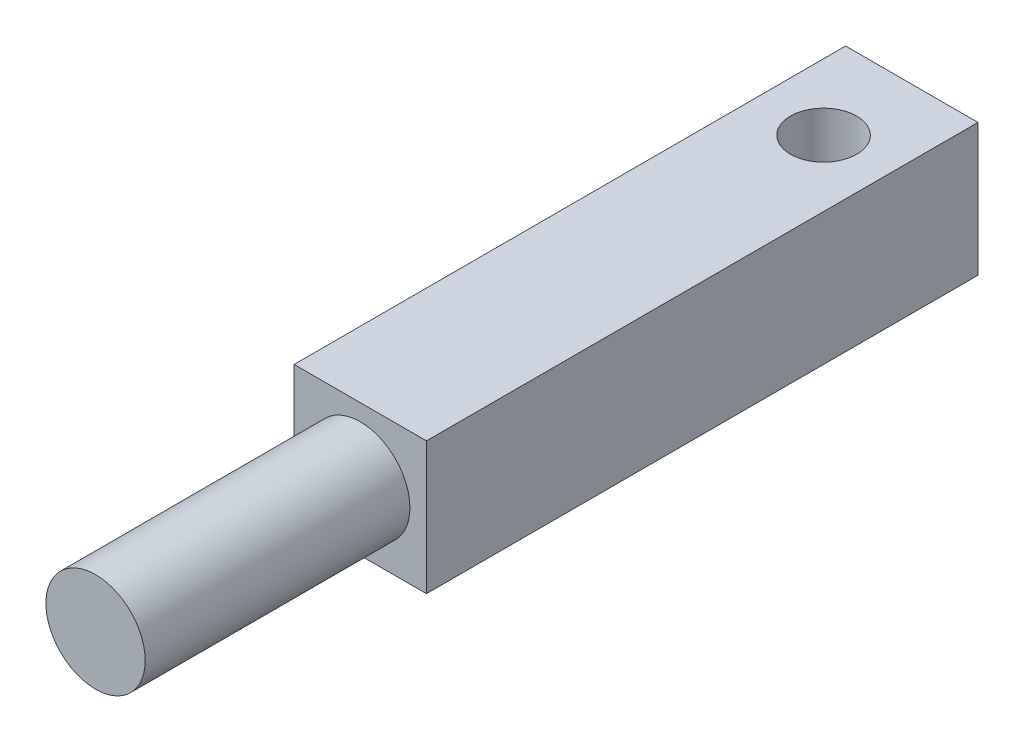
from build123d import *

# Parameters (mm, degrees)
CROQUIS1_W              = 12
CROQUIS1_H              = 12
SALIENTE_EXTRUIR1_DEPTH = 50
CROQUIS2_R              = 4.5
SALIENTE_EXTRUIR2_DEPTH = 24
CROQUIS3_R              = 3
CORTAR_EXTRUIR1_DEPTH   = 76.206382708


with BuildPart() as part:
    # Croquis1 → Saliente-Extruir1 (new body)
    with BuildSketch(Plane.XY):
        Rectangle(CROQUIS1_W, CROQUIS1_H)
    extrude(amount=SALIENTE_EXTRUIR1_DEPTH)

    # Croquis2 → Saliente-Extruir2 (add)
    with BuildSketch(Plane.XY.offset(50)):
        Circle(CROQUIS2_R)
    extrude(amount=SALIENTE_EXTRUIR2_DEPTH)

    # Croquis3 → Cortar-Extruir1 (cut, through all)
    with BuildSketch(Plane(origin=(0, 6, 0), x_dir=(1, 0, 0), z_dir=(0, 1, 0))):
        with Locations(Location((0, -8, 0), (0, 0, 270))):
            Circle(CROQUIS3_R)
    extrude(amount=-CORTAR_EXTRUIR1_DEPTH, mode=Mode.SUBTRACT)


solid = part.part
